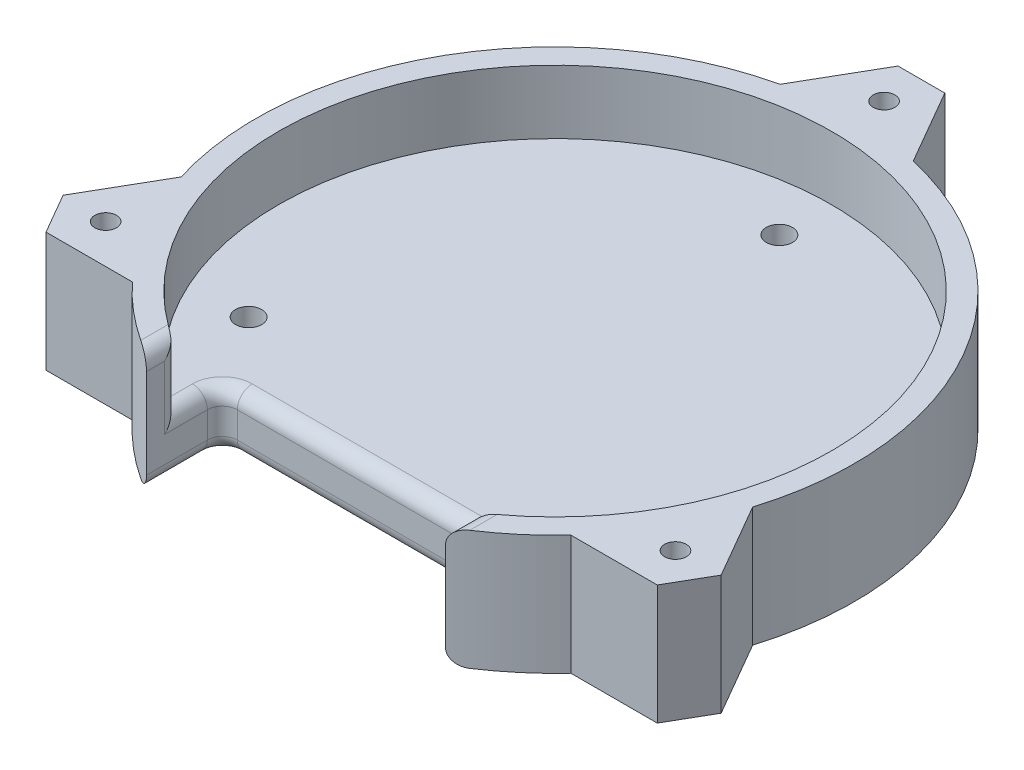
from build123d import *

# Parameters (mm, degrees)
SKETCH_1_R          = 40
EXTRUDE_1_DEPTH     = 16
SKETCH_2_R          = 37
CUT_EXTRUDE_1_DEPTH = 8.5
SKETCH_3_W          = 40
SKETCH_3_H          = 14.857277492
CUT_EXTRUDE_2_DEPTH = 59.787753827
SKETCH_4_W          = 40
SKETCH_4_H          = 3
CUT_EXTRUDE_3_DEPTH = 59.787753827
SKETCH_5_R          = 1.75
CUT_EXTRUDE_4_DEPTH = 59.787753827
EXTRUDE_2_DEPTH     = 16
SKETCH_10_R         = 1.45
CUT_EXTRUDE_5_DEPTH = 68.772200298
CUT_EXTRUDE_6_DEPTH = 2.6
SKETCH_13_R         = 3.5
CUT_EXTRUDE_7_DEPTH = 4
FILLET_2_R          = 2
FILLET_3_R          = 2


with BuildPart() as part:
    # 草图1 → 凸台-拉伸1 (new body)
    with BuildSketch(Plane(origin=(0, 0, 0), x_dir=(1, 0, 0), z_dir=(0, 1, 0))):
        with Locations(Location((0, 0, 0), (0, 0, 270))):
            Circle(SKETCH_1_R)
    extrude(amount=EXTRUDE_1_DEPTH)

    # 草图2 → 切除-拉伸1 (cut)
    with BuildSketch(Plane(origin=(0, 16, 0), x_dir=(1, 0, 0), z_dir=(0, 1, 0))):
        with Locations(Location((0, 0, 0), (0, 0, 270))):
            Circle(SKETCH_2_R)
    extrude(amount=-CUT_EXTRUDE_1_DEPTH, mode=Mode.SUBTRACT)

    # 草图3 → 切除-拉伸2 (cut, through all)
    with BuildSketch(Plane.XZ):
        with Locations((0, 34.924092916)):
            Rectangle(SKETCH_3_W, SKETCH_3_H)
    extrude(amount=-CUT_EXTRUDE_2_DEPTH, mode=Mode.SUBTRACT)

    # 草图4 → 切除-拉伸3 (cut, through all)
    with BuildSketch(Plane.XZ):
        with Locations((0, 25.99545417)):
            Rectangle(SKETCH_4_W, SKETCH_4_H)
    extrude(amount=-CUT_EXTRUDE_3_DEPTH, mode=Mode.SUBTRACT)

    # 草图5 → 切除-拉伸4 (cut, through all)
    with BuildSketch(Plane.XZ):
        with Locations(Location((0, -30, 0), (0, 0, 270))):
            Circle(SKETCH_5_R)
        with Locations(Location((-25.980762114, 15, 0), (0, 0, 270))):
            Circle(SKETCH_5_R)
        with Locations(Location((25.980762114, 15, 0), (0, 0, 270))):
            Circle(SKETCH_5_R)
    extrude(amount=-CUT_EXTRUDE_4_DEPTH, mode=Mode.SUBTRACT)

    # 草图6 → 凸台-拉伸2 (add)
    with BuildSketch(Plane.XZ):
        Polygon((29.32705693, 27.20983301), (38.222924566, 11.79016699), (43.999676996, 21.788290048), (40.874061704, 27.206080183), align=None)
        Polygon((8.900878155, -39.002892824), (-8.900878155, -38.997107176), (-3.130625811, -48.998983061), (3.124125724, -49.001015883), align=None)
        Polygon((-38.227935084, 11.793059814), (-29.322046411, 27.206940186), (-40.869051185, 27.210693013), (-43.998187428, 21.7949357), align=None)
    extrude(amount=-EXTRUDE_2_DEPTH)

    # 草图10 → 切除-拉伸5 (cut, through all)
    with BuildSketch(Plane(origin=(0, 16, 0), x_dir=(1, 0, 0), z_dir=(0, 1, 0))):
        with Locations(Location((0.000113428, 44.000000301, 0), (0, 0, 270))):
            Circle(SKETCH_10_R)
        with Locations(Location((38.105061313, -22.000098382, 0), (0, 0, 270))):
            Circle(SKETCH_10_R)
        with Locations(Location((-38.105174741, -21.999901919, 0), (0, 0, 270))):
            Circle(SKETCH_10_R)
    extrude(amount=-CUT_EXTRUDE_5_DEPTH, mode=Mode.SUBTRACT)

    # 草图11 → 切除-拉伸6 (cut)
    with BuildSketch(Plane.XZ):
        Polygon((-39.692887981, 19.249901919), (-36.517461501, 19.249901919), (-34.929748261, 21.999901919), (-36.517461501, 24.749901919), (-39.692887981, 24.749901919), (-41.280601222, 21.999901919), align=None)
        Polygon((3.175539908, -44.000000301), (1.587826668, -41.250000301), (-1.587599812, -41.250000301), (-3.175313053, -44.000000301), (-1.587599812, -46.750000301), (1.587826668, -46.750000301), align=None)
        Polygon((36.517348073, 24.750098382), (34.929634833, 22.000098382), (36.517348073, 19.250098382), (39.692774553, 19.250098382), (41.280487794, 22.000098382), (39.692774553, 24.750098382), align=None)
    extrude(amount=-CUT_EXTRUDE_6_DEPTH, mode=Mode.SUBTRACT)

    # 草图13 → 切除-拉伸7 (cut)
    with BuildSketch(Plane.XZ):
        with Locations(Location((-25.980762114, 15, 0), (0, 0, 270))):
            Circle(SKETCH_13_R)
        with Locations(Location((25.980762114, 15, 0), (0, 0, 270))):
            Circle(SKETCH_13_R)
        with Locations(Location((0, -30, 0), (0, 0, 270))):
            Circle(SKETCH_13_R)
    extrude(amount=-CUT_EXTRUDE_7_DEPTH, mode=Mode.SUBTRACT)

    # 圆角2
    fillet_2_edges = [part.edges().sort_by_distance(p)[0] for p in [
        (20, 7.5, 27.812109501),
        (-20, 7.5, 27.812109501),
        (-20, 0, 29.568235161),
        (20, 0, 29.568235161),
        (0, 7.5, 24.49545417),
        (-20, 3.75, 24.49545417),
        (20, 3.75, 24.49545417),
        (0, 0, 24.49545417),
    ]]
    fillet(fillet_2_edges, radius=FILLET_2_R)

    # 圆角3
    fillet_3_edges = [part.edges().sort_by_distance(p)[0] for p in [
        (-20, 16, 32.884890492),
        (-20, 10.75, 31.128764833),
        (20, 10.75, 31.128764833),
        (20, 16, 32.884890492),
    ]]
    fillet(fillet_3_edges, radius=FILLET_3_R)


solid = part.part
